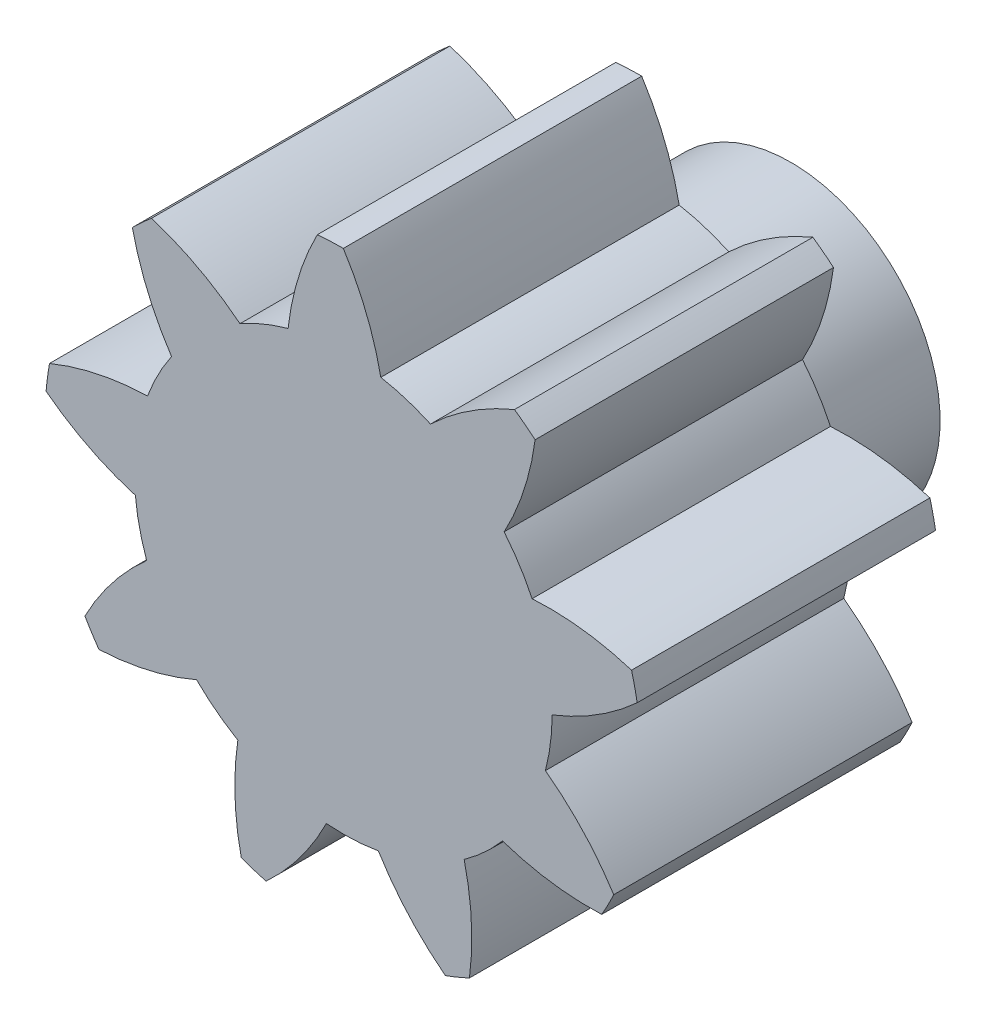
from build123d import *

# Parameters (mm, degrees)
ESQUISSE1_R                  = 10
BOSS_EXTRU_1_DEPTH           = 10
ESQUISSE2_R                  = 5
BOSS_EXTRU_2_DEPTH           = 5
ESQUISSE3_R                  = 2.5
ENL_V_MAT_EXTRU_2_DEPTH      = 5
ENL_V_START                  = -10
ENL_V_MAT_EXTRU_4_DEPTH      = 10
R_P_TITION_CIRCULAIRE2_COUNT = 9


with BuildPart() as part:
    # Esquisse1 → Boss.-Extru.1 (new body)
    with BuildSketch(Plane.XY):
        Circle(ESQUISSE1_R)
    extrude(amount=BOSS_EXTRU_1_DEPTH)

    # Esquisse2 → Boss.-Extru.2 (add)
    with BuildSketch(Plane(origin=(0, 0, 0), x_dir=(-1, 0, 0), z_dir=(0, 0, -1))):
        Circle(ESQUISSE2_R)
    extrude(amount=BOSS_EXTRU_2_DEPTH)

    # Esquisse3 → Enlèv. mat.-Extru.2 (cut)
    with BuildSketch(Plane(origin=(0, 0, -5), x_dir=(-1, 0, 0), z_dir=(0, 0, -1))):
        Circle(ESQUISSE3_R)
    extrude(amount=-ENL_V_MAT_EXTRU_2_DEPTH, mode=Mode.SUBTRACT)

    # Esquisse5 → Enlèv. mat.-Extru.4 (cut)
    with BuildSketch(Plane.XY.offset(10).offset(ENL_V_START)):
        with BuildLine():
            ThreePointArc((0, 10), (0.771400633, 8.500970859), (1.256296491, 6.886342943))
            ThreePointArc((1.256296491, 6.886342943), (2.104940597, 6.676018655), (2.920746205, 6.361543964))
            ThreePointArc((2.920746205, 6.361543964), (4.244062165, 7.406044884), (5.735764364, 8.191520443))
            ThreePointArc((5.735764364, 8.191520443), (3.007057995, 9.537169507), (0, 10))
        make_face()
    enl_v_mat_extru_4 = extrude(amount=ENL_V_MAT_EXTRU_4_DEPTH, mode=Mode.SUBTRACT)

    # Répétition circulaire2: Enlèv. mat.-Extru.4 ×9 about axis
    r_p_tition_circulaire2_axis = Axis((0, 0, 0), (0, 0, 1))
    for i in range(1, R_P_TITION_CIRCULAIRE2_COUNT):
        add(enl_v_mat_extru_4.rotate(r_p_tition_circulaire2_axis, i * 360 / R_P_TITION_CIRCULAIRE2_COUNT), mode=Mode.SUBTRACT)


solid = part.part
